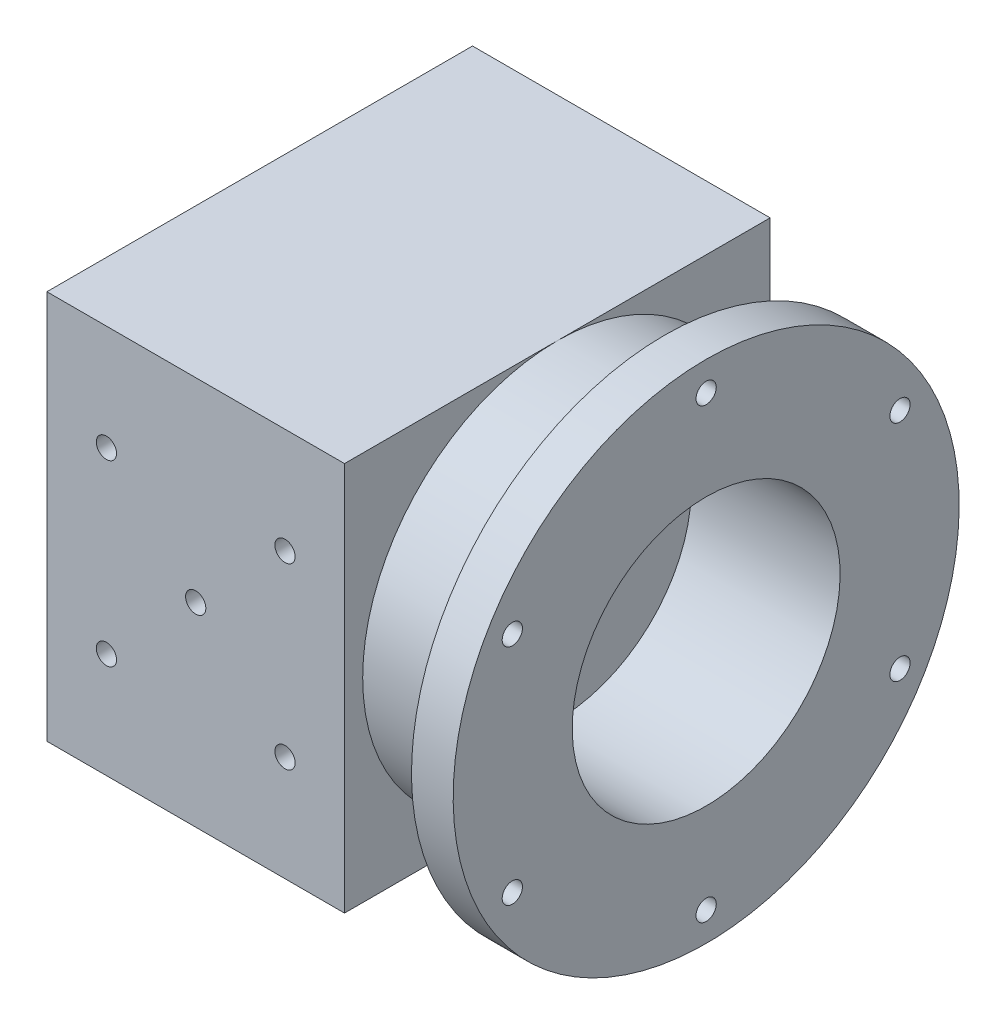
from build123d import *

# Parameters (mm, degrees)
CROQUIS1_W                            = 50
CROQUIS1_H                            = 65.4
SALIENTE_EXTRUIR1_DEPTH               = 35.75
CROQUIS2_R                            = 32.7
CROQUIS2_R_2                          = 22.5
SALIENTE_EXTRUIR2_DEPTH               = 25
CROQUIS3_R                            = 42.5
CROQUIS3_R_2                          = 32.7
SALIENTE_EXTRUIR3_DEPTH               = 7
CROQUIS5_W                            = 1.7
CROQUIS5_H                            = 7.001
TALADRO_DE_MARGEN_PARA_M31_AT_2_COUNT = 2
TALADRO_DE_MARGEN_PARA_M31_AT_2_PITCH = 37.6
TALADRO_DE_MARGEN_PARA_M31_AT_3_COUNT = 2
TALADRO_DE_MARGEN_PARA_M31_AT_3_PITCH = 65.125110365
TALADRO_DE_MARGEN_PARA_M31_AT_4_COUNT = 2
TALADRO_DE_MARGEN_PARA_M31_AT_4_PITCH = 75.2
TALADRO_DE_MARGEN_PARA_M31_AT_5_COUNT = 2
TALADRO_DE_MARGEN_PARA_M31_AT_5_PITCH = 65.125110365
TALADRO_DE_MARGEN_PARA_M31_AT_6_COUNT = 2
TALADRO_DE_MARGEN_PARA_M31_AT_6_PITCH = 37.6
CROQUIS12_W                           = 1.7
CROQUIS12_H                           = 78.25
TALADRO_DE_MARGEN_PARA_M32_AT_2_COUNT = 2
TALADRO_DE_MARGEN_PARA_M32_AT_2_PITCH = 42.426406871
TALADRO_DE_MARGEN_PARA_M32_AT_3_COUNT = 2
TALADRO_DE_MARGEN_PARA_M32_AT_3_PITCH = 30
TALADRO_DE_MARGEN_PARA_M32_AT_4_COUNT = 2
TALADRO_DE_MARGEN_PARA_M32_AT_4_PITCH = 30
TALADRO_DE_MARGEN_PARA_M32_AT_5_COUNT = 2
TALADRO_DE_MARGEN_PARA_M32_AT_5_PITCH = 21.213203436


with BuildPart() as part:
    # Croquis1 → Saliente-Extruir1 (new, symmetric)
    with BuildSketch(Plane.XY):
        Rectangle(CROQUIS1_W, CROQUIS1_H)
    extrude(amount=SALIENTE_EXTRUIR1_DEPTH, both=True)

    # Croquis12 → Taladro de margen para M32 (revolve, cut)
    with BuildSketch(Plane(origin=(15, 15, 35.75), x_dir=(0, -1, 0), z_dir=(1, 0, 0))):
        with Locations((0.85, 39.125)):
            Rectangle(CROQUIS12_W, CROQUIS12_H)
    taladro_de_margen_para_m32 = revolve(axis=Axis((15, 15, 42.1), (0, 0, -1)), mode=Mode.SUBTRACT)

    # Taladro de margen para M32 at 2: Taladro de margen para M32 ×2
    with Locations(*[Vector(-0.7071067811865475, -0.7071067811865476, 0) * (i * TALADRO_DE_MARGEN_PARA_M32_AT_2_PITCH) for i in range(1, TALADRO_DE_MARGEN_PARA_M32_AT_2_COUNT)]):
        add(taladro_de_margen_para_m32, mode=Mode.SUBTRACT)

    # Taladro de margen para M32 at 3: Taladro de margen para M32 ×2
    with Locations(*[(-i * TALADRO_DE_MARGEN_PARA_M32_AT_3_PITCH, 0, 0) for i in range(1, TALADRO_DE_MARGEN_PARA_M32_AT_3_COUNT)]):
        add(taladro_de_margen_para_m32, mode=Mode.SUBTRACT)

    # Taladro de margen para M32 at 4: Taladro de margen para M32 ×2
    with Locations(*[(0, -i * TALADRO_DE_MARGEN_PARA_M32_AT_4_PITCH, 0) for i in range(1, TALADRO_DE_MARGEN_PARA_M32_AT_4_COUNT)]):
        add(taladro_de_margen_para_m32, mode=Mode.SUBTRACT)

    # Taladro de margen para M32 at 5: Taladro de margen para M32 ×2
    with Locations(*[Vector(-0.7071067811865476, -0.7071067811865476, 0) * (i * TALADRO_DE_MARGEN_PARA_M32_AT_5_PITCH) for i in range(1, TALADRO_DE_MARGEN_PARA_M32_AT_5_COUNT)]):
        add(taladro_de_margen_para_m32, mode=Mode.SUBTRACT)


with BuildPart() as body_2:
    # Croquis2 → Saliente-Extruir2 (new body)
    with BuildSketch(Plane(origin=(25, 0, 0), x_dir=(0, 0, -1), z_dir=(1, 0, 0))):
        with Locations(Location((0, 0, 0), (0, 0, 90))):
            Circle(CROQUIS2_R)
        with Locations(Location((0, 0, 0), (0, 0, 90))):
            Circle(CROQUIS2_R_2, mode=Mode.SUBTRACT)
    extrude(amount=SALIENTE_EXTRUIR2_DEPTH)

    # Croquis3 → Saliente-Extruir3 (add)
    with BuildSketch(Plane(origin=(50, 0, 0), x_dir=(0, 0, -1), z_dir=(1, 0, 0))):
        with Locations(Location((0, 0, 0), (0, 0, 90))):
            Circle(CROQUIS3_R)
        with Locations(Location((0, 0, 0), (0, 0, 90))):
            Circle(CROQUIS3_R_2, mode=Mode.SUBTRACT)
    extrude(amount=-SALIENTE_EXTRUIR3_DEPTH)

    # Croquis5 → Taladro de margen para M31 (revolve, cut)
    with BuildSketch(Plane(origin=(50, 18.8, 32.562555182), x_dir=(0, 0, -1), z_dir=(0, 1, 0))):
        with Locations((0.85, 3.5005)):
            Rectangle(CROQUIS5_W, CROQUIS5_H)
    taladro_de_margen_para_m31 = revolve(axis=Axis((56.35, 18.8, 32.562555182), (-1, 0, 0)), mode=Mode.SUBTRACT)

    # Taladro de margen para M31 at 2: Taladro de margen para M31 ×2
    with Locations(*[Vector(0, 0.5000000000000369, -0.8660254037844175) * (i * TALADRO_DE_MARGEN_PARA_M31_AT_2_PITCH) for i in range(1, TALADRO_DE_MARGEN_PARA_M31_AT_2_COUNT)]):
        add(taladro_de_margen_para_m31, mode=Mode.SUBTRACT)

    # Taladro de margen para M31 at 3: Taladro de margen para M31 ×2
    with Locations(*[(0, 0, -i * TALADRO_DE_MARGEN_PARA_M31_AT_3_PITCH) for i in range(1, TALADRO_DE_MARGEN_PARA_M31_AT_3_COUNT)]):
        add(taladro_de_margen_para_m31, mode=Mode.SUBTRACT)

    # Taladro de margen para M31 at 4: Taladro de margen para M31 ×2
    with Locations(*[Vector(0, -0.49999999999996314, -0.8660254037844598) * (i * TALADRO_DE_MARGEN_PARA_M31_AT_4_PITCH) for i in range(1, TALADRO_DE_MARGEN_PARA_M31_AT_4_COUNT)]):
        add(taladro_de_margen_para_m31, mode=Mode.SUBTRACT)

    # Taladro de margen para M31 at 5: Taladro de margen para M31 ×2
    with Locations(*[Vector(0, -0.8660254037844175, -0.5000000000000367) * (i * TALADRO_DE_MARGEN_PARA_M31_AT_5_PITCH) for i in range(1, TALADRO_DE_MARGEN_PARA_M31_AT_5_COUNT)]):
        add(taladro_de_margen_para_m31, mode=Mode.SUBTRACT)

    # Taladro de margen para M31 at 6: Taladro de margen para M31 ×2
    with Locations(*[(0, -i * TALADRO_DE_MARGEN_PARA_M31_AT_6_PITCH, 0) for i in range(1, TALADRO_DE_MARGEN_PARA_M31_AT_6_COUNT)]):
        add(taladro_de_margen_para_m31, mode=Mode.SUBTRACT)


solid = Compound([part.part, body_2.part])
